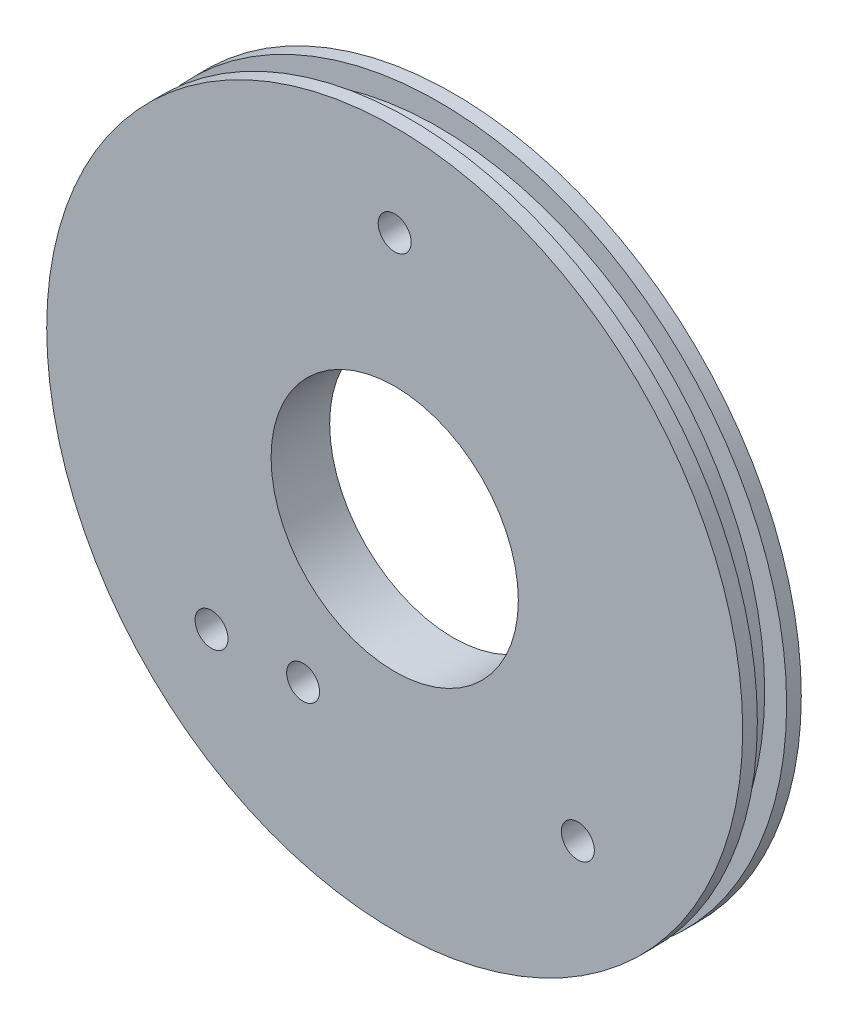
from build123d import *

# Parameters (mm, degrees)
BOSS_EXTRUDE1_DEPTH      = 8
BOSS_EXTRUDE1_DEPTH_BACK = 8
SKETCH2_R                = 95
CUT_EXTRUDE1_DEPTH       = 4
CUT_EXTRUDE1_DEPTH_BACK  = 4
SKETCH2_5_R              = 95
SKETCH2_5_R_2            = 89
SKETCH7_R                = 4.5
CUT_EXTRUDE2_DEPTH       = 167
SKETCH3_R                = 33.75
CUT_EXTRUDE3_DEPTH       = 43
CUT_EXTRUDE4_DEPTH       = 112
CUT_EXTRUDE4_DEPTH_BACK  = 60
SKETCH10_R               = 4.5


with BuildPart() as part:
    # Sketch2 → Boss-Extrude1 (new, two sides: drawn at the far end of the back side and taken through both)
    with BuildSketch(Plane.XY.offset(-BOSS_EXTRUDE1_DEPTH_BACK)):
        Circle(SKETCH2_R)
    extrude(amount=BOSS_EXTRUDE1_DEPTH + BOSS_EXTRUDE1_DEPTH_BACK)

    # Sketch2<5> → Cut-Extrude1 (cut, two sides: drawn at the far end of the back side and taken through both)
    with BuildSketch(Plane.XY.offset(-CUT_EXTRUDE1_DEPTH_BACK)):
        Circle(SKETCH2_5_R)
        Circle(SKETCH2_5_R_2, mode=Mode.SUBTRACT)
    extrude(amount=CUT_EXTRUDE1_DEPTH + CUT_EXTRUDE1_DEPTH_BACK, mode=Mode.SUBTRACT)

    # Sketch7 → Cut-Extrude2 (cut)
    with BuildSketch(Plane.XY.offset(8)):
        with Locations((-50, -48.75)):
            Circle(SKETCH7_R)
        with Locations((50, -48.75)):
            Circle(SKETCH7_R)
        with Locations((-25, -48.75)):
            Circle(SKETCH7_R)
    extrude(amount=-CUT_EXTRUDE2_DEPTH, mode=Mode.SUBTRACT)

    # Sketch3 → Cut-Extrude3 (cut)
    with BuildSketch(Plane.XY.offset(8)):
        Circle(SKETCH3_R)
    extrude(amount=-CUT_EXTRUDE3_DEPTH, mode=Mode.SUBTRACT)

    # Sketch10 → Cut-Extrude4 (cut, two sides: drawn at the far end of the back side and taken through both)
    with BuildSketch(Plane(origin=(0, 0, -8), x_dir=(-1, 0, 0), z_dir=(0, 0, -1)).offset(-CUT_EXTRUDE4_DEPTH_BACK)):
        with Locations((0, 70)):
            Circle(SKETCH10_R)
    extrude(amount=CUT_EXTRUDE4_DEPTH + CUT_EXTRUDE4_DEPTH_BACK, mode=Mode.SUBTRACT)


solid = part.part
